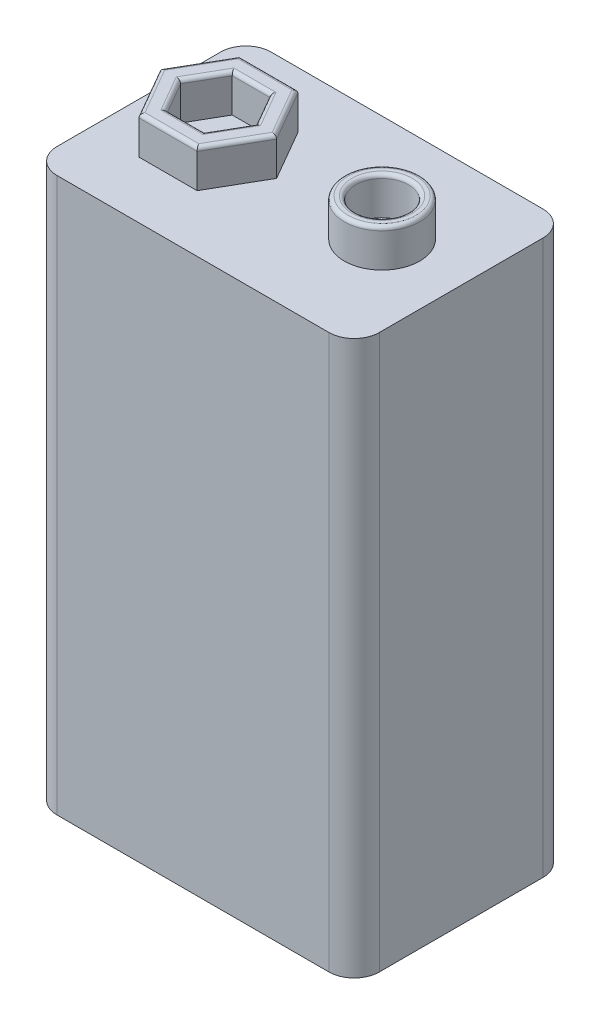
from build123d import *

# Parameters (mm, degrees)
SKETCH_1_W      = 25.6
SKETCH_1_H      = 17
EXTRUDE_1_DEPTH = 44
FILLET_1_R      = 2
SKETCH_2_R      = 3
SKETCH_2_R_2    = 2.1
EXTRUDE_2_DEPTH = 3
FILLET_2_R      = 0.3


with BuildPart() as part:
    # Эскиз1 → Бобышка-Вытянуть1 (new body)
    with BuildSketch(Plane(origin=(0, 0, 0), x_dir=(1, 0, 0), z_dir=(0, 1, 0))):
        Rectangle(SKETCH_1_W, SKETCH_1_H)
    extrude(amount=EXTRUDE_1_DEPTH)

    # Скругление1
    fillet_1_edges = [part.edges().sort_by_distance(p)[0] for p in [
        (12.8, 22, 8.5),
        (-12.8, 22, 8.5),
        (-12.8, 22, -8.5),
        (12.8, 22, -8.5),
    ]]
    fillet(fillet_1_edges, radius=FILLET_1_R)

    # Эскиз2 → Бобышка-Вытянуть2 (add)
    # profile 1 of 2: a face of its own
    with BuildSketch(Plane(origin=(0, 44, 0), x_dir=(1, 0, 0), z_dir=(0, 1, 0))):
        with Locations(Location((6.497670016, 0.020872179, 0), (0, 0, 90))):
            Circle(SKETCH_2_R)
        with Locations(Location((6.497670016, 0.020872179, 0), (0, 0, 270))):
            Circle(SKETCH_2_R_2, mode=Mode.SUBTRACT)
    # profile 2 of 2: a face of its own
    with BuildSketch(Plane(origin=(0, 44, 0), x_dir=(1, 0, 0), z_dir=(0, 1, 0))):
        Polygon((-1.883527831, 0.020872179), (-4.192928907, 4.020872179), (-8.811731061, 4.020872179), (-11.121132138, 0.020872179), (-8.811731061, -3.979127821), (-4.192928907, -3.979127821), align=None)
        Polygon((-3.500108584, 0.020872179), (-5.001219284, 2.620872179), (-8.003440684, 2.620872179), (-9.504551384, 0.020872179), (-8.003440684, -2.579127821), (-5.001219284, -2.579127821), align=None, mode=Mode.SUBTRACT)
    extrude(amount=EXTRUDE_2_DEPTH)

    # Скругление2
    fillet_2_edges = [part.edges().sort_by_distance(p)[0] for p in [
        (6.497670016, 47, 2.979127821),
        (6.497670016, 47, -2.120872179),
        (-3.038228369, 47, 1.979127821),
        (-3.038228369, 47, -2.020872179),
        (-6.502329984, 47, -4.020872179),
        (-9.966431599, 47, -2.020872179),
        (-9.966431599, 47, 1.979127821),
        (-6.502329984, 47, 3.979127821),
        (-4.250663934, 47, 1.279127821),
        (-4.250663934, 47, -1.320872179),
        (-6.502329984, 47, -2.620872179),
        (-8.753996034, 47, -1.320872179),
        (-8.753996034, 47, 1.279127821),
        (-6.502329984, 47, 2.579127821),
    ]]
    fillet(fillet_2_edges, radius=FILLET_2_R)


solid = part.part
